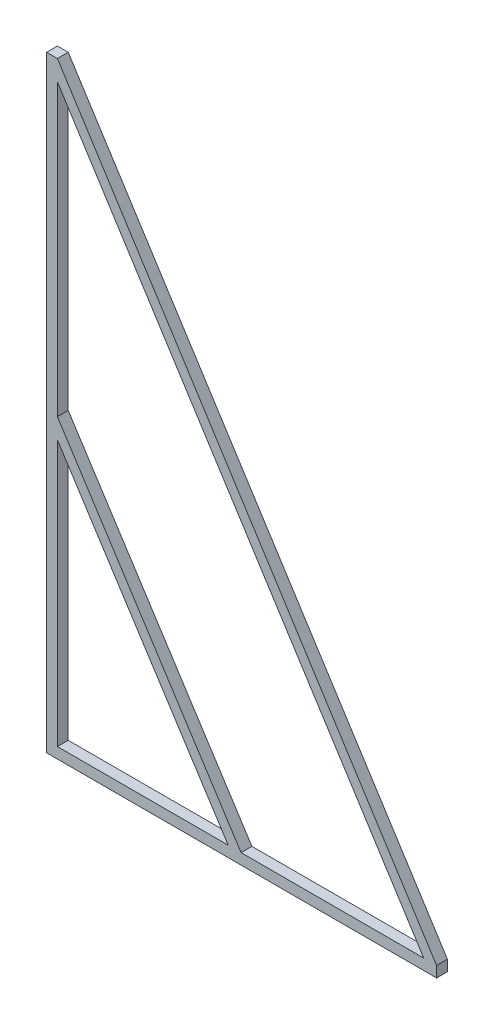
from build123d import *

# Parameters (mm, degrees)
BOSS_EXTRUDE1_DEPTH = 5


with BuildPart() as part:
    # Sketch1 → Boss-Extrude1 (new body)
    with BuildSketch(Plane.XY):
        Polygon((0, 0), (0, 280), (5, 280), (180, 5), (180, 0), align=None)
        Polygon((89.757735174, 5), (174.073452359, 5), (5, 270.686853707), (5, 136.845365827), align=None, mode=Mode.SUBTRACT)
        Polygon((5, 5), (5, 127.599078617), (83.813693397, 5), align=None, mode=Mode.SUBTRACT)
    extrude(amount=BOSS_EXTRUDE1_DEPTH)


solid = part.part
